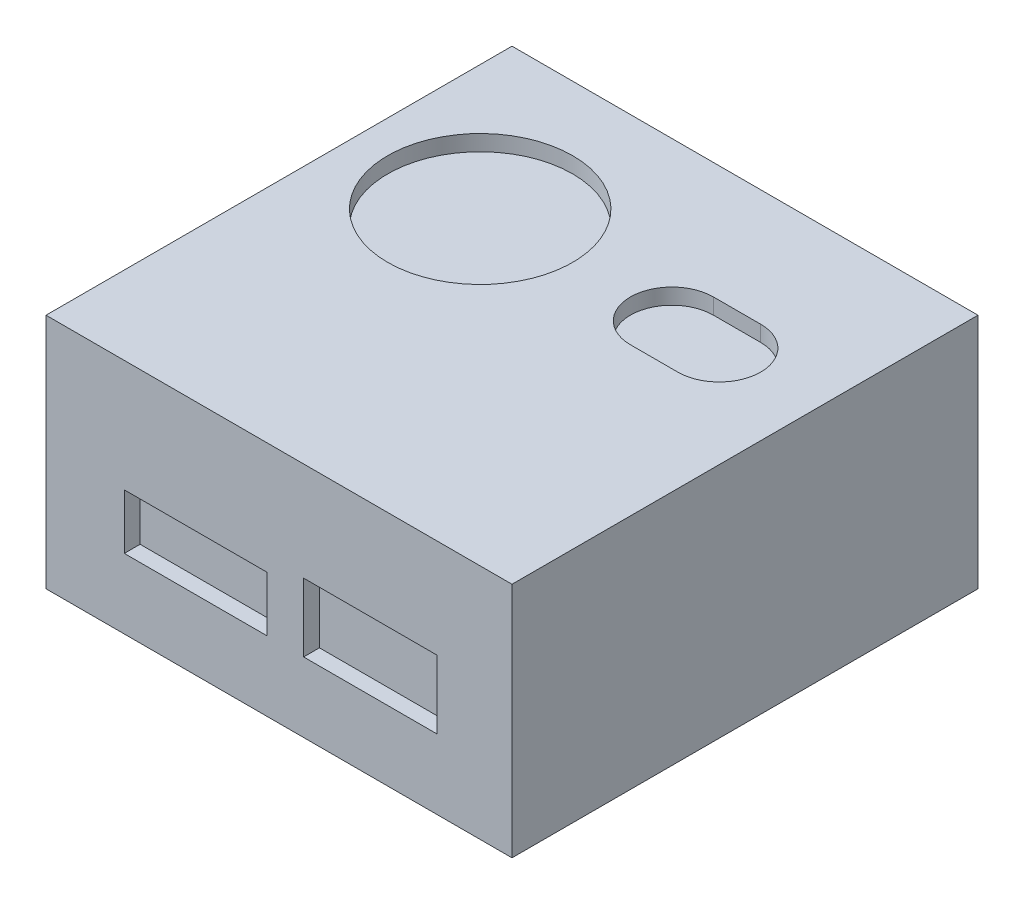
from build123d import *

# Parameters (mm, degrees)
SKETCH_1_W          = 29.5
SKETCH_1_H          = 29.5
EXTRUDE_1_DEPTH     = 15
SKETCH_4_R          = 5.854360827
CUT_EXTRUDE_1_DEPTH = 1
SKETCH_5_W          = 8.438163648
SKETCH_5_H          = 4.320992013
SKETCH_5_W_2        = 9.049624782
SKETCH_5_H_2        = 3.485328464
CUT_EXTRUDE_2_DEPTH = 1


with BuildPart() as part:
    # 草图1 → 凸台-拉伸1 (new body)
    with BuildSketch(Plane(origin=(0, 0, 0), x_dir=(1, 0, 0), z_dir=(0, 1, 0))):
        Rectangle(SKETCH_1_W, SKETCH_1_H)
    extrude(amount=EXTRUDE_1_DEPTH)

    # 草图4 → 切除-拉伸1 (cut)
    with BuildSketch(Plane(origin=(0, 15, 0), x_dir=(1, 0, 0), z_dir=(0, 1, 0))):
        with Locations(Location((-6.828709963, 4.814266748, 0), (0, 0, 270))):
            Circle(SKETCH_4_R)
        with BuildLine():
            Line((5.371174923, 7.377688131), (8.366864515, 7.377688131))
            ThreePointArc((8.366864515, 7.377688131), (10.991875344, 4.752677302), (8.366864515, 2.127666472))
            Line((8.366864515, 2.127666472), (5.371174923, 2.127666472))
            ThreePointArc((5.371174923, 2.127666472), (2.746164094, 4.752677302), (5.371174923, 7.377688131))
        make_face()
    extrude(amount=-CUT_EXTRUDE_1_DEPTH, mode=Mode.SUBTRACT)

    # 草图5 → 切除-拉伸2 (cut)
    with BuildSketch(Plane.XY.offset(14.75)):
        with Locations((5.778081635, 6.579139216)):
            Rectangle(SKETCH_5_W, SKETCH_5_H)
        with Locations((-5.268982852, 6.161307442)):
            Rectangle(SKETCH_5_W_2, SKETCH_5_H_2)
    extrude(amount=-CUT_EXTRUDE_2_DEPTH, mode=Mode.SUBTRACT)


solid = part.part
